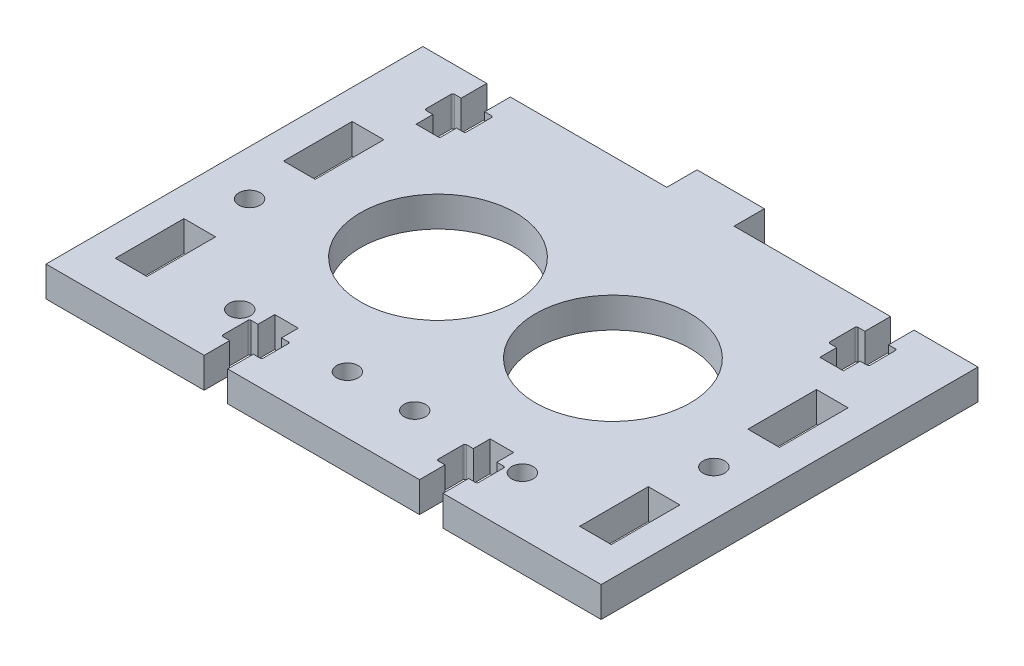
from build123d import *

# Parameters (mm, degrees)
SKETCH1_W          = 82.5
SKETCH1_H          = 56
MAINSHAPE_DEPTH    = 4.5
SKETCH2_W          = 10
SKETCH2_H          = 9
TAB1_DEPTH         = 4.5
CUT_EXTRUDE2_DEPTH = 53.707328712
SKETCH5_R          = 1.6
SKETCH5_W          = 4.7
SKETCH5_H          = 10.2
CUT_EXTRUDE3_DEPTH = 53.707328712
SKETCH6_R          = 11.5
CUT_EXTRUDE4_DEPTH = 53.707328712
SKETCH8_R          = 1.6
CUT_EXTRUDE6_DEPTH = 53.707328712
CUT_EXTRUDE7_DEPTH = 53.707328712


with BuildPart() as part:
    # Sketch1 → MainShape (new body)
    with BuildSketch(Plane(origin=(0, 0, 0), x_dir=(1, 0, 0), z_dir=(0, 1, 0))):
        Rectangle(SKETCH1_W, SKETCH1_H)
    extrude(amount=MAINSHAPE_DEPTH)

    # Sketch2 → Tab1 (add, through all)
    with BuildSketch(Plane(origin=(0, 4.5, 0), x_dir=(1, 0, 0), z_dir=(0, 1, 0))):
        with Locations((0, 28)):
            Rectangle(SKETCH2_W, SKETCH2_H)
    extrude(amount=-TAB1_DEPTH)

    # Sketch4 → Cut-Extrude2 (cut, through all)
    with BuildSketch(Plane(origin=(0, 4.5, 0), x_dir=(1, 0, 0), z_dir=(0, 1, 0))):
        with BuildLine():
            Line((-28.25, 17.5), (-31.75, 17.5))
            Line((-31.75, 17.5), (-31.75, 20))
            Line((-31.75, 20), (-32.75, 20))
            ThreePointArc((-32.75, 20), (-32.926776695, 20.073223305), (-33, 20.25))
            Line((-33, 20.25), (-33, 23.95))
            ThreePointArc((-33, 23.95), (-32.926776695, 24.126776695), (-32.75, 24.2))
            Line((-32.75, 24.2), (-31.75, 24.2))
            Line((-31.75, 24.2), (-31.75, 28))
            Line((-31.75, 28), (-28.25, 28))
            Line((-28.25, 28), (-28.25, 24.2))
            Line((-28.25, 24.2), (-27.25, 24.2))
            ThreePointArc((-27.25, 24.2), (-27.073223305, 24.126776695), (-27, 23.95))
            Line((-27, 23.95), (-27, 20.25))
            ThreePointArc((-27, 20.25), (-27.073223305, 20.073223305), (-27.25, 20))
            Line((-27.25, 20), (-28.25, 20))
            Line((-28.25, 20), (-28.25, 17.5))
        make_face()
        with BuildLine():
            Line((28.25, 17.5), (28.25, 20))
            Line((28.25, 20), (27.25, 20))
            ThreePointArc((27.25, 20), (27.073223305, 20.073223305), (27, 20.25))
            Line((27, 20.25), (27, 23.95))
            ThreePointArc((27, 23.95), (27.073223305, 24.126776695), (27.25, 24.2))
            Line((27.25, 24.2), (28.25, 24.2))
            Line((28.25, 24.2), (28.25, 28))
            Line((28.25, 28), (31.75, 28))
            Line((31.75, 28), (31.75, 24.2))
            Line((31.75, 24.2), (32.75, 24.2))
            ThreePointArc((32.75, 24.2), (32.926776695, 24.126776695), (33, 23.95))
            Line((33, 23.95), (33, 20.25))
            ThreePointArc((33, 20.25), (32.926776695, 20.073223305), (32.75, 20))
            Line((32.75, 20), (31.75, 20))
            Line((31.75, 20), (31.75, 17.5))
            Line((31.75, 17.5), (28.25, 17.5))
        make_face()
    extrude(amount=-CUT_EXTRUDE2_DEPTH, mode=Mode.SUBTRACT)

    # Sketch5 → Cut-Extrude3 (cut, through all)
    with BuildSketch(Plane(origin=(0, 4.5, 0), x_dir=(1, 0, 0), z_dir=(0, 1, 0))):
        with Locations(Location((34.5, -4.5, 0), (0, 0, 270))):
            Circle(SKETCH5_R)
        with Locations(Location((-34.5, -4.5, 0), (0, 0, 90))):
            Circle(SKETCH5_R)
        with Locations((34.5, 8)):
            Rectangle(SKETCH5_W, SKETCH5_H)
        with Locations((-34.5, 8)):
            Rectangle(SKETCH5_W, SKETCH5_H)
        with Locations((-34.5, -17)):
            Rectangle(SKETCH5_W, SKETCH5_H)
        with Locations((34.5, -17)):
            Rectangle(SKETCH5_W, SKETCH5_H)
    extrude(amount=-CUT_EXTRUDE3_DEPTH, mode=Mode.SUBTRACT)

    # Sketch6 → Cut-Extrude4 (cut, through all)
    with BuildSketch(Plane(origin=(0, 4.5, 0), x_dir=(1, 0, 0), z_dir=(0, 1, 0))):
        with Locations(Location((-13, 2, 0), (0, 0, 270))):
            Circle(SKETCH6_R)
    cut_extrude4 = extrude(amount=-CUT_EXTRUDE4_DEPTH, mode=Mode.SUBTRACT)

    # Sketch8 → Cut-Extrude6 (cut, through all)
    with BuildSketch(Plane(origin=(0, 4.5, 0), x_dir=(1, 0, 0), z_dir=(0, 1, 0))):
        with Locations(Location((-21, -19.46, 0), (0, 0, 270))):
            Circle(SKETCH8_R)
        with Locations(Location((-5, -19.46, 0), (0, 0, 90))):
            Circle(SKETCH8_R)
    cut_extrude6 = extrude(amount=-CUT_EXTRUDE6_DEPTH, mode=Mode.SUBTRACT)

    # Sketch9 → Cut-Extrude7 (cut, through all)
    with BuildSketch(Plane(origin=(0, 4.5, 0), x_dir=(1, 0, 0), z_dir=(0, 1, 0))):
        with BuildLine():
            Line((17.75, -28), (17.75, -24.2))
            Line((17.75, -24.2), (18.75, -24.2))
            ThreePointArc((18.75, -24.2), (18.926776695, -24.126776695), (19, -23.95))
            Line((19, -23.95), (19, -20.25))
            ThreePointArc((19, -20.25), (18.926776695, -20.073223305), (18.75, -20))
            Line((18.75, -20), (17.75, -20))
            Line((17.75, -20), (17.75, -17.5))
            Line((17.75, -17.5), (14.25, -17.5))
            Line((14.25, -17.5), (14.25, -20))
            Line((14.25, -20), (13.25, -20))
            ThreePointArc((13.25, -20), (13.073223305, -20.073223305), (13, -20.25))
            Line((13, -20.25), (13, -23.95))
            ThreePointArc((13, -23.95), (13.073223305, -24.126776695), (13.25, -24.2))
            Line((13.25, -24.2), (14.25, -24.2))
            Line((14.25, -24.2), (14.25, -28))
            Line((14.25, -28), (17.75, -28))
        make_face()
        with BuildLine():
            Line((-14.25, -28), (-14.25, -24.2))
            Line((-14.25, -24.2), (-13.25, -24.2))
            ThreePointArc((-13.25, -24.2), (-13.073223305, -24.126776695), (-13, -23.95))
            Line((-13, -23.95), (-13, -20.25))
            ThreePointArc((-13, -20.25), (-13.073223305, -20.073223305), (-13.25, -20))
            Line((-13.25, -20), (-14.25, -20))
            Line((-14.25, -20), (-14.25, -17.5))
            Line((-14.25, -17.5), (-17.75, -17.5))
            Line((-17.75, -17.5), (-17.75, -20))
            Line((-17.75, -20), (-18.75, -20))
            ThreePointArc((-18.75, -20), (-18.926776695, -20.073223305), (-19, -20.25))
            Line((-19, -20.25), (-19, -23.95))
            ThreePointArc((-19, -23.95), (-18.926776695, -24.126776695), (-18.75, -24.2))
            Line((-18.75, -24.2), (-17.75, -24.2))
            Line((-17.75, -24.2), (-17.75, -28))
            Line((-17.75, -28), (-14.25, -28))
        make_face()
    extrude(amount=-CUT_EXTRUDE7_DEPTH, mode=Mode.SUBTRACT)

    # Mirror1: Cut-Extrude4, Cut-Extrude6 across plane
    add(cut_extrude4.mirror(Plane(origin=(0, 0, 0), x_dir=(0, 0, 1), z_dir=(1, 0, 0))), mode=Mode.SUBTRACT)
    add(cut_extrude6.mirror(Plane(origin=(0, 0, 0), x_dir=(0, 0, 1), z_dir=(1, 0, 0))), mode=Mode.SUBTRACT)


solid = part.part
